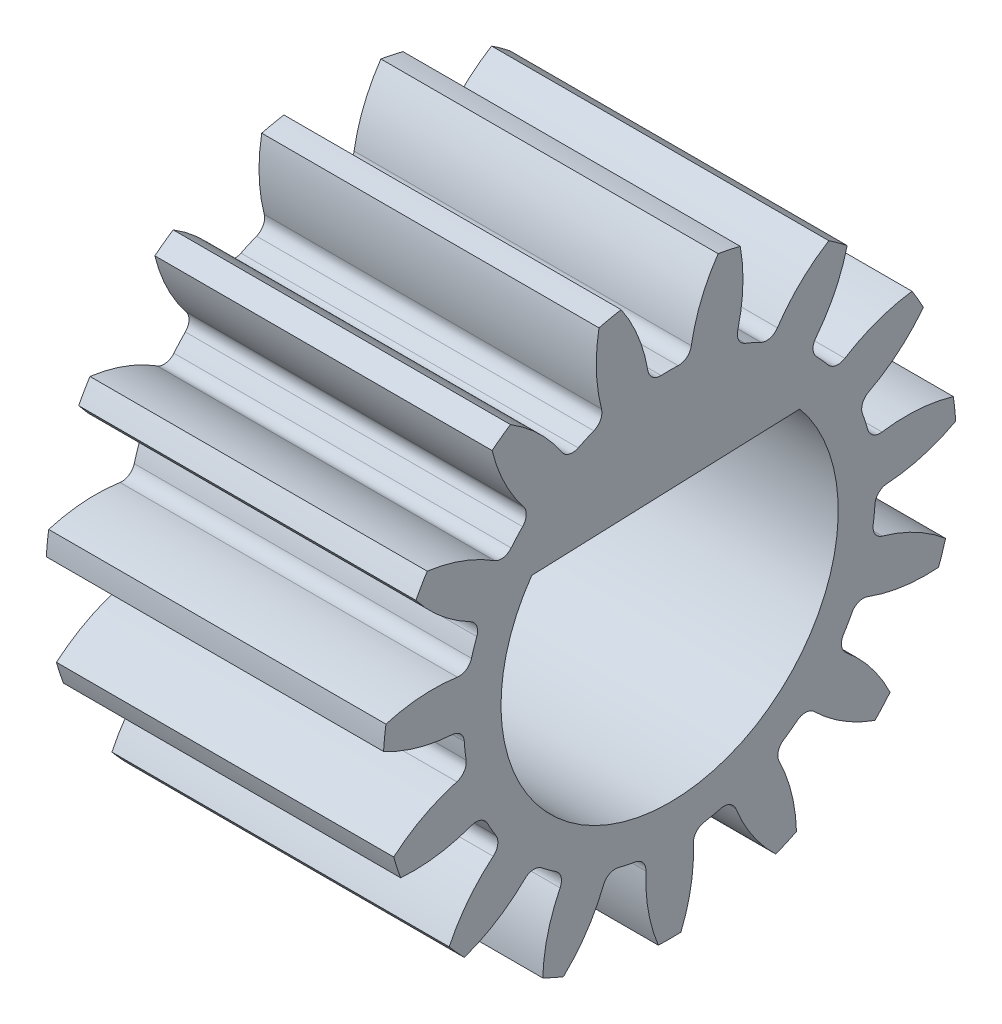
from build123d import *

# Parameters (mm, degrees)
SKETCH1_R                = 8.5
SKETCH1_R_2              = 5
BOSS_EXTRUDE2_DEPTH      = 10
CUT_EXTRUDE1_DEPTH       = 16.636495771
FILLET1_R                = 0.38
CIRPATTERN2_COUNT        = 15
FILLET1_OF_CIRPATTERN2_R = 0.38
BOSS_EXTRUDE3_DEPTH      = 10


with BuildPart() as part:
    # Sketch1 → Boss-Extrude2 (new body)
    with BuildSketch(Plane(origin=(0, 0, 0), x_dir=(0, 0, -1), z_dir=(1, 0, 0))):
        Circle(SKETCH1_R)
        Circle(SKETCH1_R_2, mode=Mode.SUBTRACT)
    extrude(amount=BOSS_EXTRUDE2_DEPTH)

    # Sketch3 → Cut-Extrude1 (cut, through all)
    with BuildSketch(Plane(origin=(10, 0, 0), x_dir=(0, 0, -1), z_dir=(1, 0, 0))):
        with BuildLine():
            ThreePointArc((0.597861759, 6.070631048), (0, 6.1), (-0.597861759, 6.070631048))
            ThreePointArc((-0.597861759, 6.070631048), (-0.872223827, 7.277041555), (-1.437516016, 8.377562158))
            ThreePointArc((-1.437516016, 8.377562158), (0, 8.5), (1.437516016, 8.377562158))
            ThreePointArc((1.437516016, 8.377562158), (0.872223827, 7.277041555), (0.597861759, 6.070631048))
        make_face()
    cut_extrude1 = extrude(amount=-CUT_EXTRUDE1_DEPTH, mode=Mode.SUBTRACT)

    # Fillet1
    fillet1_edges = [part.edges().sort_by_distance(p)[0] for p in [
        (5, 6.070631048, 0.597861759),
        (5, 6.070631048, -0.597861759),
    ]]
    fillet(fillet1_edges, radius=FILLET1_R)

    # CirPattern2: Cut-Extrude1 ×15 about axis
    cirpattern2_axis = Axis((0, 0, 0), (1, 0, 0))
    for i in range(1, CIRPATTERN2_COUNT):
        add(cut_extrude1.rotate(cirpattern2_axis, i * 360 / CIRPATTERN2_COUNT), mode=Mode.SUBTRACT)

    # Fillet1 of CirPattern2
    fillet1_of_cirpattern2_edges = [part.edges().sort_by_distance(p)[0] for p in [
        (5, 5.302625134, 3.015321988),
        (5, 5.788969704, 1.922974199),
        (5, 3.617747161, 4.911405652),
        (5, 4.506342907, 4.111310449),
        (5, 1.307327838, 5.95826266),
        (5, 2.444528482, 5.588763772),
        (5, -1.229140344, 5.974881925),
        (5, -0.039967124, 6.099869067),
        (5, -3.553078995, 4.958389825),
        (5, -2.517552052, 5.556251584),
        (5, -5.262658009, 3.084547078),
        (5, -4.559829359, 4.051907725),
        (5, -6.062275643, 0.67735812),
        (5, -5.813670745, 1.846952211),
        (5, -5.813670745, -1.846952211),
        (5, -6.062275643, -0.67735812),
        (5, -4.559829359, -4.051907725),
        (5, -5.262658009, -3.084547078),
        (5, -2.517552052, -5.556251584),
        (5, -3.553078995, -4.958389825),
        (5, -0.039967124, -6.099869067),
        (5, -1.229140344, -5.974881925),
        (5, 2.444528482, -5.588763772),
        (5, 1.307327838, -5.95826266),
        (5, 4.506342907, -4.111310449),
        (5, 3.617747161, -4.911405652),
        (5, 5.788969704, -1.922974199),
        (5, 5.302625134, -3.015321988),
    ]]
    fillet(fillet1_of_cirpattern2_edges, radius=FILLET1_OF_CIRPATTERN2_R)

    # Sketch4 → Boss-Extrude3 (add)
    with BuildSketch(Plane(origin=(10, 0, 0), x_dir=(0, 0, -1), z_dir=(1, 0, 0))):
        with BuildLine():
            Line((-4.087945559, 2.879010439), (3.859294095, 3.178969815))
            ThreePointArc((3.859294095, 3.178969815), (-0.189049853, 5.008759864), (-4.087945559, 2.879010439))
        make_face()
    extrude(amount=-BOSS_EXTRUDE3_DEPTH)


solid = part.part
